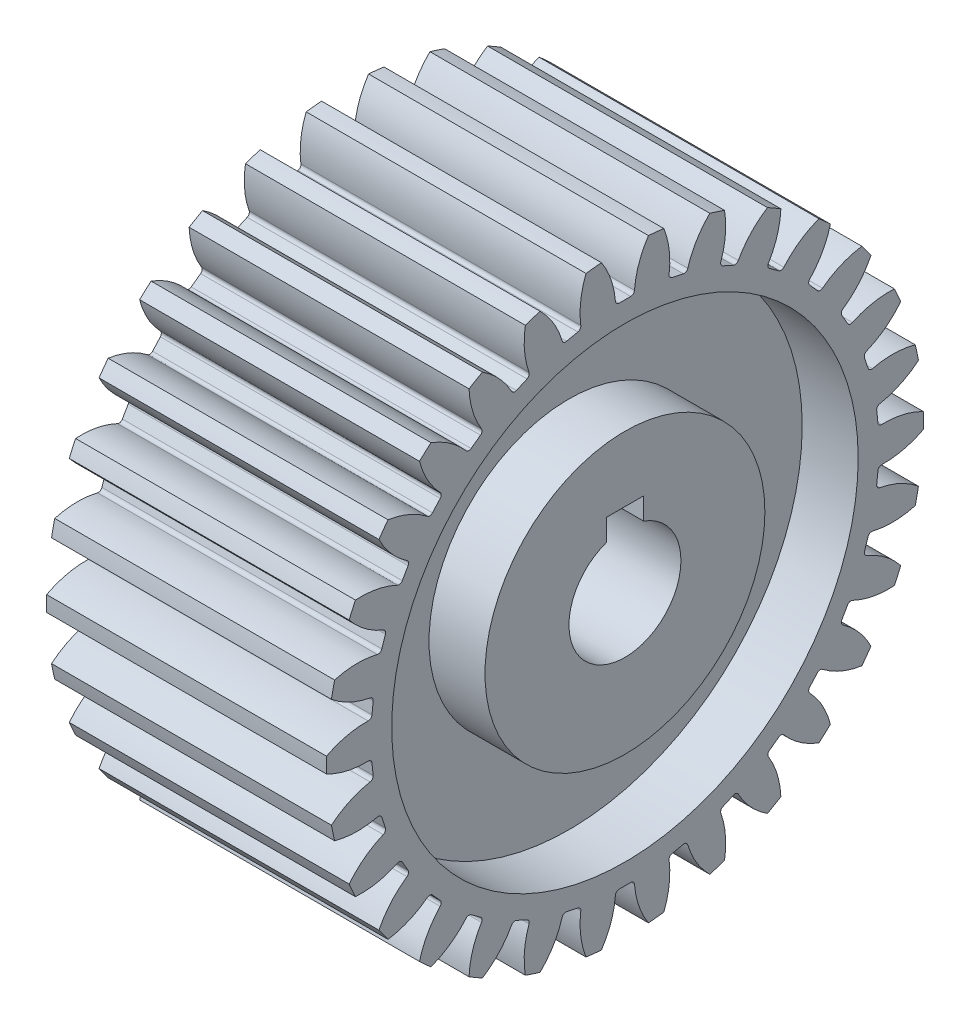
from build123d import *

# Parameters (mm, degrees)
SKETCH1_R                        = 16
CIRCULAR_EXTRUDE_DEPTH           = 7.5
CUT_CIRCULAR_TOP_RECTANGLE_DEPTH = 28.147743921
SKETCH4_R                        = 12.5
SKETCH4_R_2                      = 7.5
EXTRUDE_CUT_RAD_25_15_DEPTH      = 3
CUT_TOOTH_DEPTH                  = 28.147743921
F_30_NOS_COUNT                   = 30


with BuildPart() as part:
    # Sketch1 → circular - extrude (new, symmetric)
    with BuildSketch(Plane(origin=(0, 0, 0), x_dir=(0, 0, -1), z_dir=(1, 0, 0))):
        Circle(SKETCH1_R)
    extrude(amount=CIRCULAR_EXTRUDE_DEPTH, both=True)

    # Sketch3 → Cut- circular + top rectangle (cut, through all)
    with BuildSketch(Plane(origin=(7.5, 0, 0), x_dir=(0, 0, -1), z_dir=(1, 0, 0))):
        with BuildLine():
            Line((-1, 2.828427125), (-1, 4))
            Line((-1, 4), (1, 4))
            Line((1, 4), (1, 2.828427125))
            ThreePointArc((1, 2.828427125), (0, -3), (-1, 2.828427125))
        make_face()
    extrude(amount=-CUT_CIRCULAR_TOP_RECTANGLE_DEPTH, mode=Mode.SUBTRACT)

    # Sketch4 → extrude cut ( rad: 25 -15) (cut)
    with BuildSketch(Plane(origin=(7.5, 0, 0), x_dir=(0, 0, -1), z_dir=(1, 0, 0))):
        Circle(SKETCH4_R)
        Circle(SKETCH4_R_2, mode=Mode.SUBTRACT)
    extrude_cut_rad_25_15 = extrude(amount=-EXTRUDE_CUT_RAD_25_15_DEPTH, mode=Mode.SUBTRACT)

    # mirror - extrude cut: extrude cut ( rad: 25 -15) across plane
    add(extrude_cut_rad_25_15.mirror(Plane(origin=(0, 0, 0), x_dir=(0, 0, 1), z_dir=(1, 0, 0))), mode=Mode.SUBTRACT)

    # Sketch5 → Cut - tooth (cut, through all)
    with BuildSketch(Plane(origin=(7.5, 0, 0), x_dir=(0, 0, -1), z_dir=(1, 0, 0))):
        with BuildLine():
            ThreePointArc((-0.510792361, 13.784267691), (-0.447157321, 13.653121714), (-0.311412085, 13.6))
            Line((-0.311412085, 13.6), (0.311412085, 13.6))
            ThreePointArc((0.311412085, 13.6), (0.447157321, 13.653121714), (0.510792361, 13.784267691))
            ThreePointArc((0.510792361, 13.784267691), (0.746805037, 14.91511034), (1.259418951, 15.950356231))
            ThreePointArc((1.259418951, 15.950356231), (0, 16), (-1.259418951, 15.950356231))
            ThreePointArc((-1.259418951, 15.950356231), (-0.746805037, 14.91511034), (-0.510792361, 13.784267691))
        make_face()
    cut_tooth = extrude(amount=-CUT_TOOTH_DEPTH, mode=Mode.SUBTRACT)

    # 30 nos: Cut - tooth ×30 about axis
    f_30_nos_axis = Axis((0, 0, 0), (1, 0, 0))
    for i in range(1, F_30_NOS_COUNT):
        add(cut_tooth.rotate(f_30_nos_axis, i * 360 / F_30_NOS_COUNT), mode=Mode.SUBTRACT)


solid = part.part
